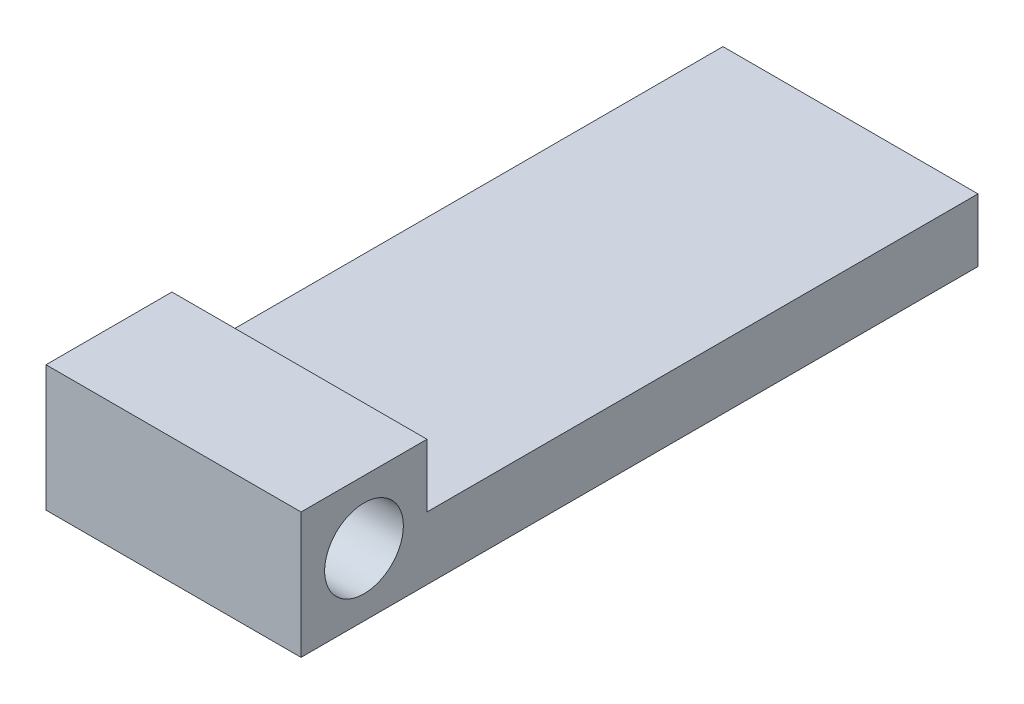
from build123d import *

# Parameters (mm, degrees)
SKETCH1_W           = 8.1
SKETCH1_H           = 4
BOSS_EXTRUDE1_DEPTH = 4
SKETCH2_R           = 1.25
CUT_EXTRUDE1_DEPTH  = 9
SKETCH4_W           = 8.1
SKETCH4_H           = 17.5
BOSS_EXTRUDE2_DEPTH = 2


with BuildPart() as part:
    # Sketch1 → Boss-Extrude1 (new body)
    with BuildSketch(Plane(origin=(0, 0, 0), x_dir=(1, 0, 0), z_dir=(0, 1, 0))):
        with Locations((4.05, 2)):
            Rectangle(SKETCH1_W, SKETCH1_H)
    extrude(amount=BOSS_EXTRUDE1_DEPTH)

    # Sketch2 → Cut-Extrude1 (cut)
    with BuildSketch(Plane(origin=(8.1, 0, 0), x_dir=(0, 0, -1), z_dir=(1, 0, 0))):
        with Locations((2, 2)):
            Circle(SKETCH2_R)
    extrude(amount=-CUT_EXTRUDE1_DEPTH, mode=Mode.SUBTRACT)

    # Sketch4 → Boss-Extrude2 (add)
    with BuildSketch(Plane(origin=(0, 0, 0), x_dir=(-1, 0, 0), z_dir=(0, -1, 0))):
        with Locations((-4.05, 12.75)):
            Rectangle(SKETCH4_W, SKETCH4_H)
    extrude(amount=-BOSS_EXTRUDE2_DEPTH)


solid = part.part
